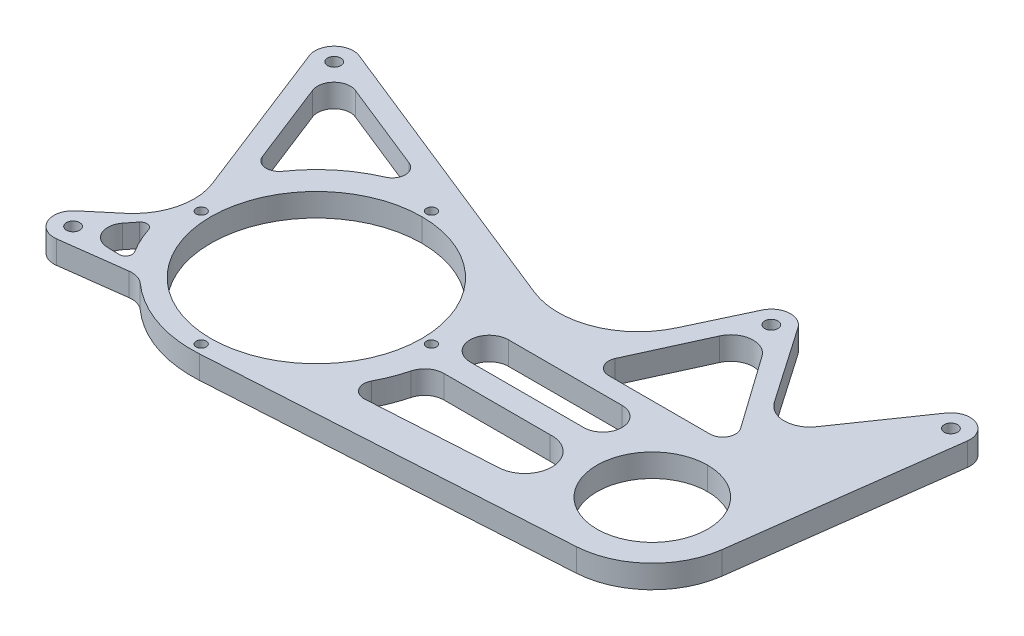
from build123d import *

# Parameters (mm, degrees)
SKETCH1_R             = 52.3875
SKETCH1_R_2           = 27.5
BOSS_EXTRUDE1_DEPTH   = 5.715
M6_CLEARANCE_HOLE1_D  = 6.6
F_5_0MM_DOWEL_HOLE1_D = 5
CIRPATTERN1_COUNT     = 4
CUT_EXTRUDE3_DEPTH    = 284.979078357
CUT_EXTRUDE4_DEPTH    = 284.979078357


with BuildPart() as part:
    # Sketch1 → Boss-Extrude1 (new, symmetric)
    with BuildSketch(Plane(origin=(0, 0, 0), x_dir=(1, 0, 0), z_dir=(0, 1, 0))):
        with BuildLine():
            Line((-62.780706514, -68.14502812), (-207.974881785, -9.956762437))
            ThreePointArc((-207.974881785, -9.956762437), (-218.225236723, -12.034965467), (-220.388836369, -22.267635732))
            Line((-220.388836369, -22.267635732), (-189.430137427, -101.422354045))
            ThreePointArc((-189.430137427, -101.422354045), (-188.283833694, -119.954004575), (-198.151371623, -135.681934472))
            Line((-198.151371623, -135.681934472), (-211.707233022, -147.086764223))
            ThreePointArc((-211.707233022, -147.086764223), (-214.295764489, -158.206433226), (-204.355245166, -163.82191268))
            Line((-204.355245166, -163.82191268), (-172.443362527, -159.700770109))
            ThreePointArc((-172.443362527, -159.700770109), (-168.164823601, -160.06920649), (-164.426538493, -162.182702446))
            ThreePointArc((-164.426538493, -162.182702446), (-143.500663309, -174.487669009), (-119.452254321, -177.801047868))
            Line((-119.452254321, -177.801047868), (57.036931174, -167.126674483))
            ThreePointArc((57.036931174, -167.126674483), (82.017871973, -156.408307566), (94.466622628, -132.24305566))
            Line((94.466622628, -132.24305566), (108.629935196, -24.576488538))
            ThreePointArc((108.629935196, -24.576488538), (102.609116202, -14.445444869), (91.348434445, -17.92184438))
            Line((91.348434445, -17.92184438), (65.060480918, -55.990558325))
            ThreePointArc((65.060480918, -55.990558325), (54.61, -61.474087679), (44.159519082, -55.990558325))
            Line((44.159519082, -55.990558325), (17.871565555, -17.92184438))
            ThreePointArc((17.871565555, -17.92184438), (9.247910088, -13.841666007), (1.412558245, -19.284326264))
            Line((1.412558245, -19.284326264), (-12.176603989, -48.212200061))
            ThreePointArc((-12.176603989, -48.212200061), (-33.518744337, -68.231765471), (-62.780706514, -68.14502812))
        make_face()
        with Locations(Location((-123.19, -116.001477372, 0), (0, 0, 270))):
            Circle(SKETCH1_R, mode=Mode.SUBTRACT)
        with Locations(Location((54.61, -127, 0), (0, 0, 270))):
            Circle(SKETCH1_R_2, mode=Mode.SUBTRACT)
    extrude(amount=BOSS_EXTRUDE1_DEPTH, both=True)

    # M6 Clearance Hole1 (through all)
    with Locations(Plane(origin=(0, -5.715, 0), x_dir=(-1, 0, 0), z_dir=(0, -1, 0))):
        with Locations((-222.084502927, -125.821700696), (-10.033704867, -23.334197365), (-99.186295133, -23.334197365), (211.518182886, -18.798178744), (205.575185514, -154.375359311)):
            Hole(M6_CLEARANCE_HOLE1_D / 2)

    # Ø5.0mm Dowel Hole1 (through all)
    with Locations(Plane(origin=(0, 5.715, 0), x_dir=(1, 0, 0), z_dir=(0, 1, 0))):
        with Locations((-123.19, -173.151477372)):
            f_5_0mm_dowel_hole1 = Hole(F_5_0MM_DOWEL_HOLE1_D / 2)

    # CirPattern1: Ø5.0mm Dowel Hole1 ×4 about axis
    cirpattern1_axis = Axis((-123.19, 0, 116.001477372), (0, 1, 0))
    for i in range(1, CIRPATTERN1_COUNT):
        add(f_5_0mm_dowel_hole1.rotate(cirpattern1_axis, i * 360 / CIRPATTERN1_COUNT), mode=Mode.SUBTRACT)

    # Sketch12 → Cut-Extrude3 (cut, through all)
    with BuildSketch(Plane.XZ.offset(5.715)):
        with BuildLine():
            Line((-14.234653979, 76.580666612), (2.016277078, 40.924992231))
            ThreePointArc((2.016277078, 40.924992231), (11.084872861, 34.469497273), (21.201297863, 39.113933708))
            Line((21.201297863, 39.113933708), (46.984841737, 75.545913676))
            ThreePointArc((46.984841737, 75.545913676), (47.441443369, 82.132150292), (41.801580719, 85.564197365))
            Line((41.801580719, 85.564197365), (-8.456504121, 85.564197365))
            ThreePointArc((-8.456504121, 85.564197365), (-13.797169823, 82.649279585), (-14.234653979, 76.580666612))
        make_face()
        with BuildLine():
            Line((-204.660650751, 36.331409888), (-188.626913597, 77.326218823))
            ThreePointArc((-188.626913597, 77.326218823), (-183.343464985, 81.400582198), (-177.265672517, 78.648182362))
            ThreePointArc((-177.265672517, 78.648182362), (-164.864290964, 65.181201114), (-149.229324423, 55.657458697))
            ThreePointArc((-149.229324423, 55.657458697), (-145.319075006, 49.625624375), (-149.386073966, 43.698348841))
            Line((-149.386073966, 43.698348841), (-194.042740287, 25.801666969))
            ThreePointArc((-194.042740287, 25.801666969), (-202.810079512, 27.579196728), (-204.660650751, 36.331409888))
        make_face()
        with BuildLine():
            Line((-190.985681304, 136.027573744), (-194.692687992, 140.689511725))
            ThreePointArc((-194.692687992, 140.689511725), (-195.773357295, 149.809803058), (-188.096484537, 154.850952212))
            Line((-188.096484537, 154.850952212), (-182.142551509, 155.01295786))
            ThreePointArc((-182.142551509, 155.01295786), (-179.298484939, 153.425933155), (-179.332786017, 150.169219243))
            ThreePointArc((-179.332786017, 150.169219243), (-182.766707481, 143.751485155), (-185.46990532, 136.993390091))
            ThreePointArc((-185.46990532, 136.993390091), (-187.940827525, 134.871620657), (-190.985681304, 136.027573744))
        make_face()
    extrude(amount=-CUT_EXTRUDE3_DEPTH, mode=Mode.SUBTRACT)

    # Sketch13 → Cut-Extrude4 (cut, through all)
    with BuildSketch(Plane.XZ.offset(5.715)):
        with BuildLine():
            Line((7.636577505, 114.096477372), (-48.751422495, 114.096477372))
            ThreePointArc((-48.751422495, 114.096477372), (-58.276422495, 104.571477372), (-48.751422495, 95.046477372))
            Line((-48.751422495, 95.046477372), (7.636577505, 95.046477372))
            ThreePointArc((7.636577505, 95.046477372), (17.161577505, 104.571477372), (7.636577505, 114.096477372))
        make_face()
        with BuildLine():
            ThreePointArc((-59.54342217, 132.642118181), (-56.149544678, 127.512420027), (-50.328184067, 125.526477372))
            Line((-50.328184067, 125.526477372), (2.447685954, 125.526477372))
            ThreePointArc((2.447685954, 125.526477372), (16.711385269, 138.163192745), (4.074669896, 152.42689206))
            Line((4.074669896, 152.42689206), (-58.528880044, 156.213263816))
            Line((-58.528880044, 156.213263816), (-59.309504972, 156.260477372))
            ThreePointArc((-59.309504972, 156.260477372), (-64.85762699, 153.125613078), (-65.035173244, 146.755565245))
            ThreePointArc((-65.035173244, 146.755565245), (-61.881820392, 139.857397165), (-59.54342217, 132.642118181))
        make_face()
    extrude(amount=-CUT_EXTRUDE4_DEPTH, mode=Mode.SUBTRACT)


solid = part.part
